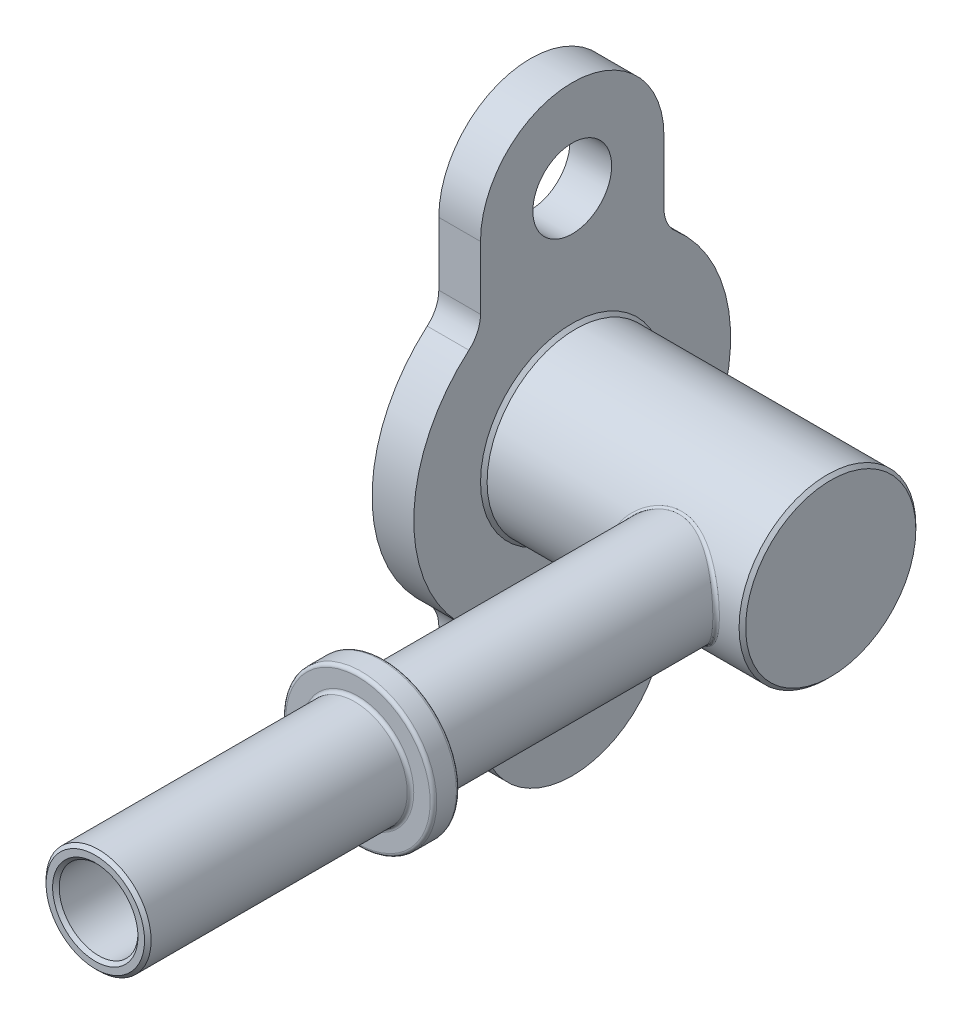
from build123d import *

# Parameters (mm, degrees)
SKETCH1_R          = 3
EXTRUDE1_DEPTH     = 3.175
SKETCH2_R          = 6.731
EXTRUDE2_DEPTH     = 19.685
SKETCH4_R          = 4
SKETCH4_R_2        = 3
EXTRUDE3_DEPTH     = 28
SKETCH5_R          = 5.75
SKETCH5_R_2        = 3
EXTRUDE4_DEPTH     = 2
SKETCH6_R          = 4
SKETCH6_R_2        = 3
EXTRUDE5_DEPTH     = 20
CHAMFER1_SIZE      = 0.25
FILLET1_R          = 0.25
FILLET2_R          = 2.54
SKETCH7_R          = 6.35
CUT_EXTRUDE1_DEPTH = 20.32
CUT_EXTRUDE2_START = -45.72
SKETCH8_R          = 3
CUT_EXTRUDE2_DEPTH = 45.72


with BuildPart() as part:
    # Sketch1 → Extrude1 (new body)
    with BuildSketch(Plane(origin=(0, 0, 0), x_dir=(0, 0, -1), z_dir=(1, 0, 0))):
        with BuildLine():
            Line((-6.985, -15.875), (-6.985, -9.837377699))
            ThreePointArc((-6.985, -9.837377699), (-12.065, 0), (-6.985, 9.837377699))
            Line((-6.985, 9.837377699), (-6.985, 15.875))
            ThreePointArc((-6.985, 15.875), (0, 22.86), (6.985, 15.875))
            Line((6.985, 15.875), (6.985, 9.837377699))
            ThreePointArc((6.985, 9.837377699), (12.065, 0), (6.985, -9.837377699))
            Line((6.985, -9.837377699), (6.985, -15.875))
            ThreePointArc((6.985, -15.875), (0, -22.86), (-6.985, -15.875))
        make_face()
        with Locations((0, 15.875)):
            Circle(SKETCH1_R, mode=Mode.SUBTRACT)
        with Locations((0, -15.875)):
            Circle(SKETCH1_R, mode=Mode.SUBTRACT)
    extrude(amount=EXTRUDE1_DEPTH)

    # Sketch2 → Extrude2 (add)
    with BuildSketch(Plane(origin=(3.175, 0, 0), x_dir=(0, 0, -1), z_dir=(1, 0, 0))):
        with Locations(Location((0, 0, 0), (0, 0, 180))):
            Circle(SKETCH2_R)
    extrude(amount=EXTRUDE2_DEPTH)

    # Sketch4 → Extrude3 (add)
    with BuildSketch(Plane.XY):
        with Locations((16.86, 0)):
            Circle(SKETCH4_R)
        with Locations((16.86, 0)):
            Circle(SKETCH4_R_2, mode=Mode.SUBTRACT)
    extrude(amount=EXTRUDE3_DEPTH)

    # Sketch5 → Extrude4 (add)
    with BuildSketch(Plane.XY.offset(28)):
        with Locations((16.86, 0)):
            Circle(SKETCH5_R)
        with Locations((16.86, 0)):
            Circle(SKETCH5_R_2, mode=Mode.SUBTRACT)
    extrude(amount=EXTRUDE4_DEPTH)

    # Sketch6 → Extrude5 (add)
    with BuildSketch(Plane.XY.offset(30)):
        with Locations((16.86, 0)):
            Circle(SKETCH6_R)
        with Locations((16.86, 0)):
            Circle(SKETCH6_R_2, mode=Mode.SUBTRACT)
    extrude(amount=EXTRUDE5_DEPTH)

    # Chamfer1
    chamfer1_edges = [part.edges().sort_by_distance(p)[0] for p in [
        (3.175, 0, -6.731),
        (22.86, 0, -6.731),
        (12.86, 0, 50),
        (13.86, 0, 50),
    ]]
    chamfer(chamfer1_edges, length=CHAMFER1_SIZE)

    # Fillet1
    fillet1_edges = [part.edges().sort_by_distance(p)[0] for p in [
        (16.86, -4, 5.413534982),
        (12.86, 0, 28),
        (11.11, 0, 30),
        (11.11, 0, 28),
        (12.86, 0, 30),
    ]]
    fillet(fillet1_edges, radius=FILLET1_R)

    # Fillet2
    fillet2_edges = [part.edges().sort_by_distance(p)[0] for p in [
        (1.5875, 9.837377699, -6.985),
        (1.5875, -9.837377699, -6.985),
        (1.5875, -9.837377699, 6.985),
        (1.5875, 9.837377699, 6.985),
    ]]
    fillet(fillet2_edges, radius=FILLET2_R)

    # Sketch7 → Cut-Extrude1 (cut)
    with BuildSketch(Plane.ZY):
        Circle(SKETCH7_R)
    extrude(amount=-CUT_EXTRUDE1_DEPTH, mode=Mode.SUBTRACT)

    # Sketch8 → Cut-Extrude2 (cut)
    with BuildSketch(Plane.XY.offset(50).offset(CUT_EXTRUDE2_START)):
        with Locations((16.86, 0)):
            Circle(SKETCH8_R)
    extrude(amount=CUT_EXTRUDE2_DEPTH, mode=Mode.SUBTRACT)


solid = part.part
